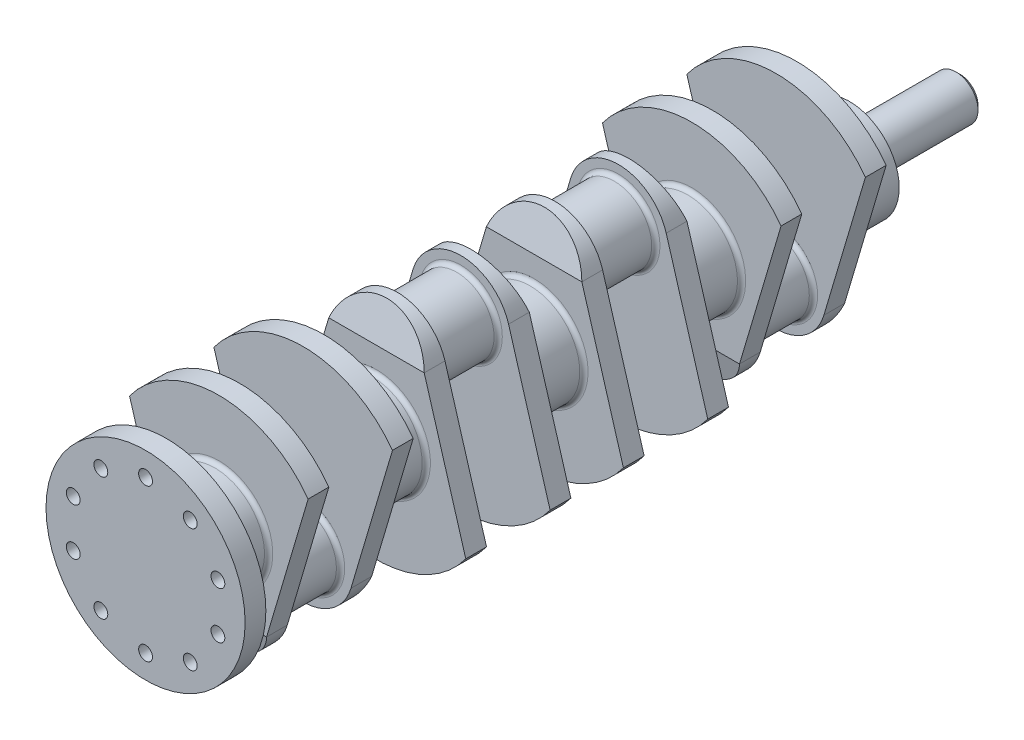
from build123d import *

# Parameters (mm, degrees)
SKETCH1_R               = 36
BOSS_EXTRUDE1_DEPTH     = 38
SKETCH2_R               = 27
BOSS_EXTRUDE2_DEPTH     = 15
SKETCH2_2_R             = 27
BOSS_EXTRUDE3_DEPTH     = 61
CUT_EXTRUDE3_DEPTH      = 143.724458813
CUT_EXTRUDE3_DEPTH_BACK = 143.724458813
BODY_MOVE_COPY1_ANGLE   = 180
SKETCH5_R               = 72
SKETCH5_R_2             = 5
BOSS_EXTRUDE4_DEPTH     = 15
SKETCH6_R               = 16
BOSS_EXTRUDE5_DEPTH     = 80
CHAMFER1_SIZE           = 3
FILLET1_R               = 3


with BuildPart() as part:
    # Sketch1 → Boss-Extrude1 (new body)
    with BuildSketch(Plane.XY):
        Circle(SKETCH1_R)
    extrude(amount=BOSS_EXTRUDE1_DEPTH)

    # Sketch2 → Boss-Extrude2 (add)
    with BuildSketch(Plane.XY.offset(38)):
        with BuildLine():
            Line((-34.517510455, -54.224552409), (-64.569893475, 47.23059238))
            ThreePointArc((-64.569893475, 47.23059238), (0, 80), (64.569893475, 47.23059238))
            Line((64.569893475, 47.23059238), (34.517510455, -54.224552409))
            ThreePointArc((34.517510455, -54.224552409), (0, -80), (-34.517510455, -54.224552409))
        make_face()
        with Locations(Location((0, -44, 0), (0, 0, 144.817798311))):
            Circle(SKETCH2_R, mode=Mode.SUBTRACT)
    extrude(amount=BOSS_EXTRUDE2_DEPTH)

    # Sketch2<2> → Boss-Extrude3 (add)
    with BuildSketch(Plane.XY.offset(38)):
        with Locations(Location((0, -44, 0), (0, 0, 180))):
            Circle(SKETCH2_2_R)
    extrude(amount=BOSS_EXTRUDE3_DEPTH)

    # Sketch4 → Cut-Extrude3 (cut, two sides: drawn at the far end of the back side and taken through both)
    with BuildSketch(Plane(origin=(0, 0, 0), x_dir=(0, 0, -1), z_dir=(1, 0, 0)).offset(-CUT_EXTRUDE3_DEPTH_BACK)):
        Polygon((-45.5, -80), (-38, -80), (-38, -54.224552409), align=None)
    extrude(amount=CUT_EXTRUDE3_DEPTH + CUT_EXTRUDE3_DEPTH_BACK, mode=Mode.SUBTRACT)

    # Mirror1: part across plane


with BuildPart() as part_1:
    add(part.part)
    add(part.part.mirror(Plane.XY.offset(76)))


with BuildPart() as body_2:
    # Mirror2: mirrored copy
    add(part_1.part.mirror(Plane.XY.offset(133)))


with BuildPart() as body_2_1:
    # Body-Move/Copy1: moved
    add(body_2.part.rotate(Axis((0, 0, 0), (0, 0, 1)), BODY_MOVE_COPY1_ANGLE))


with BuildPart() as body_3:
    # Mirror3: mirrored copy
    add(body_2_1.part.mirror(Plane.XY.offset(247)))


with BuildPart() as body_4:
    # Mirror3 2: mirrored copy
    add(part_1.part.mirror(Plane.XY.offset(247)))


with BuildPart() as part_2:
    add(part_1.part)

    # Combine1: union body 2, body 3, body 4
    add(body_2_1.part)
    add(body_3.part)
    add(body_4.part)

    # Sketch5 → Boss-Extrude4 (add)
    with BuildSketch(Plane.XY.offset(494)):
        Circle(SKETCH5_R)
        with Locations((0, 55)):
            Circle(SKETCH5_R_2, mode=Mode.SUBTRACT)
        with Locations((32.328188876, 44.495934691)):
            Circle(SKETCH5_R_2, mode=Mode.SUBTRACT)
        with Locations((52.308108396, 16.995934691)):
            Circle(SKETCH5_R_2, mode=Mode.SUBTRACT)
        with Locations((52.308108396, -16.995934691)):
            Circle(SKETCH5_R_2, mode=Mode.SUBTRACT)
        with Locations((32.328188876, -44.495934691)):
            Circle(SKETCH5_R_2, mode=Mode.SUBTRACT)
        with Locations((0, -55)):
            Circle(SKETCH5_R_2, mode=Mode.SUBTRACT)
        with Locations((-32.328188876, -44.495934691)):
            Circle(SKETCH5_R_2, mode=Mode.SUBTRACT)
        with Locations((-52.308108396, -16.995934691)):
            Circle(SKETCH5_R_2, mode=Mode.SUBTRACT)
        with Locations((-52.308108396, 16.995934691)):
            Circle(SKETCH5_R_2, mode=Mode.SUBTRACT)
        with Locations((-32.328188876, 44.495934691)):
            Circle(SKETCH5_R_2, mode=Mode.SUBTRACT)
    extrude(amount=BOSS_EXTRUDE4_DEPTH)

    # Sketch6 → Boss-Extrude5 (add)
    with BuildSketch(Plane(origin=(0, 0, 0), x_dir=(-1, 0, 0), z_dir=(0, 0, -1))):
        Circle(SKETCH6_R)
    extrude(amount=BOSS_EXTRUDE5_DEPTH)

    # Chamfer1
    chamfer1_edges = [part_2.edges().sort_by_distance(p)[0] for p in [
        (16, 0, -80),
    ]]
    chamfer(chamfer1_edges, length=CHAMFER1_SIZE)

    # Fillet1
    fillet1_edges = [part_2.edges().sort_by_distance(p)[0] for p in [
        (27, -44, 53),
        (16, 0, 0),
        (27, -44, 99),
        (-36, 0, 38),
        (-36, 0, 114),
        (-36, 0, 152),
        (36, 0, 228),
        (-27, 44, 213),
        (-27, 44, 167),
        (36, 0, 266),
        (-27, 44, 281),
        (36, 0, 342),
        (-27, 44, 327),
        (-36, 0, 456),
        (-36, 0, 494),
        (27, -44, 441),
        (27, -44, 395),
        (36, 0, 380),
    ]]
    fillet(fillet1_edges, radius=FILLET1_R)


solid = part_2.part
